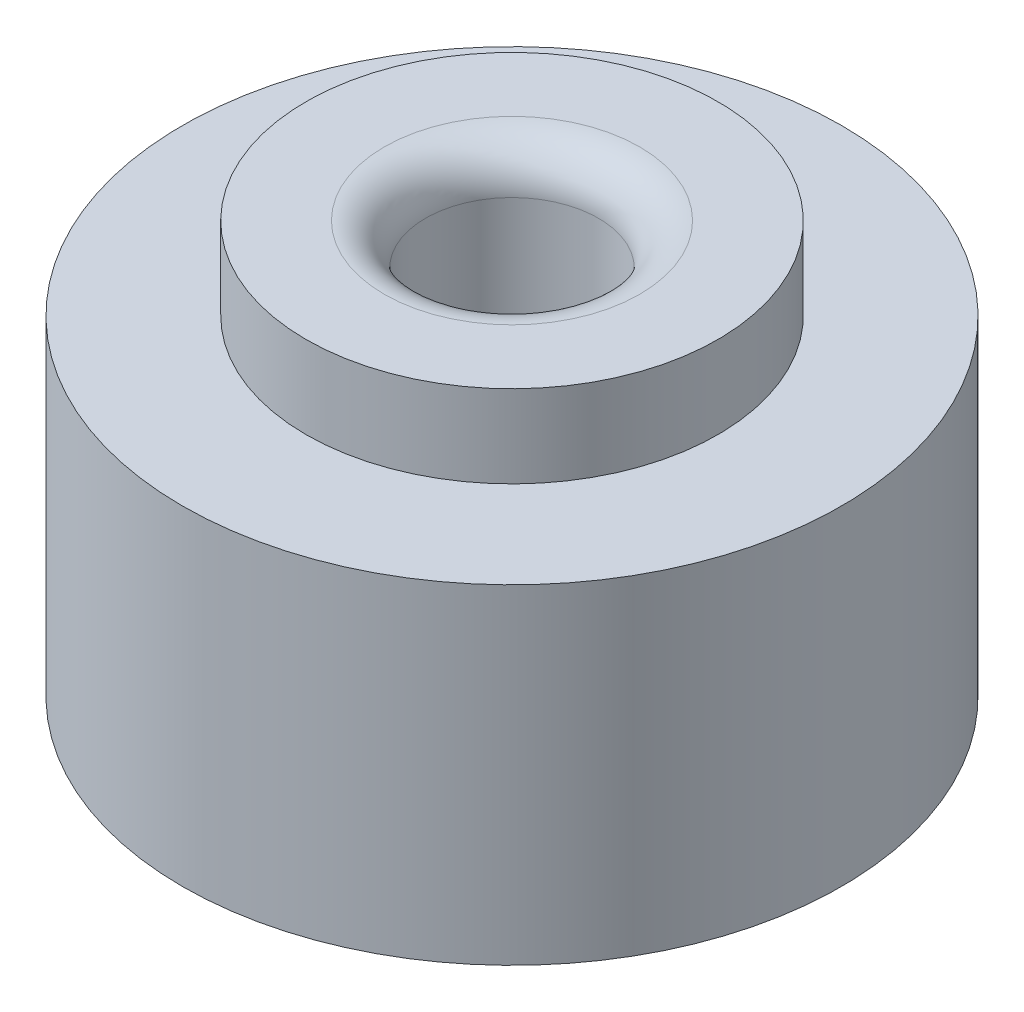
from build123d import *

# Parameters (mm, degrees)
SKETCH1_R           = 4
SKETCH1_R_2         = 1.05
BOSS_EXTRUDE1_DEPTH = 4
SKETCH2_R           = 2.5
BOSS_EXTRUDE2_DEPTH = 1
SKETCH1_2_R         = 1.05
CUT_EXTRUDE1_DEPTH  = 8.549834435
FILLET1_R           = 0.5


with BuildPart() as part:
    # Sketch1 → Boss-Extrude1 (new body)
    with BuildSketch(Plane(origin=(0, 0, 0), x_dir=(1, 0, 0), z_dir=(0, 1, 0))):
        Circle(SKETCH1_R)
        Circle(SKETCH1_R_2, mode=Mode.SUBTRACT)
    extrude(amount=BOSS_EXTRUDE1_DEPTH)

    # Sketch2 → Boss-Extrude2 (add)
    with BuildSketch(Plane(origin=(0, 4, 0), x_dir=(1, 0, 0), z_dir=(0, 1, 0))):
        Circle(SKETCH2_R)
    extrude(amount=BOSS_EXTRUDE2_DEPTH)

    # Sketch1<2> → Cut-Extrude1 (cut, through all)
    with BuildSketch(Plane(origin=(0, 0, 0), x_dir=(1, 0, 0), z_dir=(0, 1, 0))):
        Circle(SKETCH1_2_R)
    extrude(amount=CUT_EXTRUDE1_DEPTH, mode=Mode.SUBTRACT)

    # Fillet1
    fillet1_edges = [part.edges().sort_by_distance(p)[0] for p in [
        (-1.05, 0, 0),
        (-1.05, 5, 0),
    ]]
    fillet(fillet1_edges, radius=FILLET1_R)


solid = part.part
